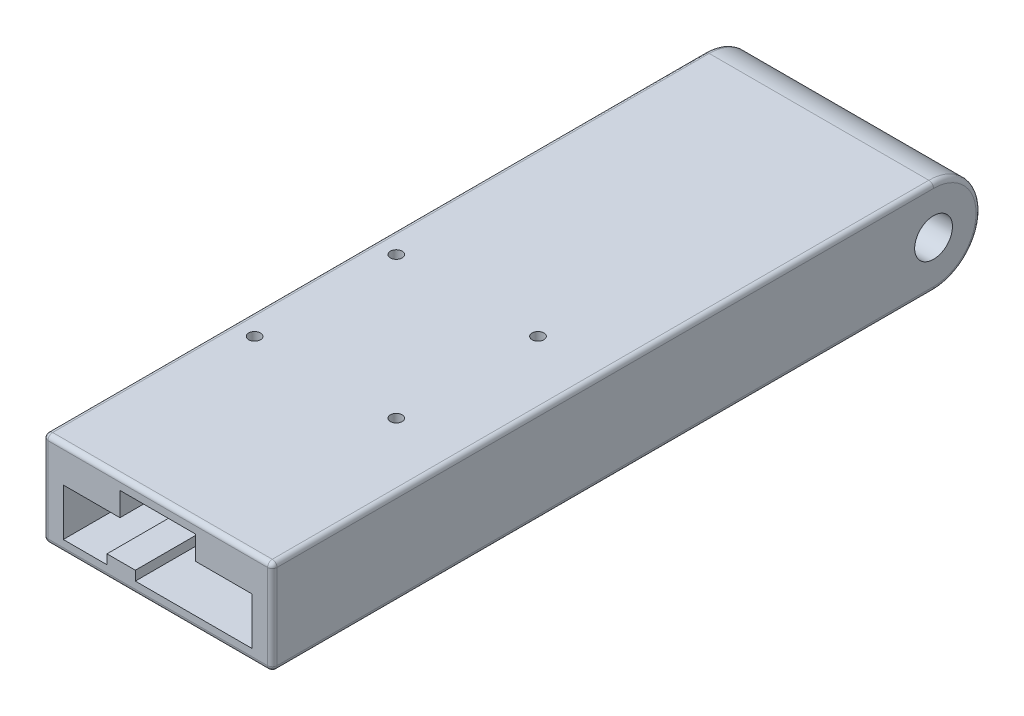
from build123d import *

# Parameters (mm, degrees)
SKETCH_1_W               = 48.5
SKETCH_1_H               = 150
EXTRUDE_1_DEPTH          = 20
CUT_EXTRUDE_1_REACH      = 93.527
CUT_EXTRUDE_2_REACH      = 93.527
SKETCH_4_R               = 4
M3X0_5_1_D               = 2.5
M3X0_5_1_DEPTH           = 7.5
M3X0_5_1_TIP             = 0.751075774
CUT_EXTRUDE_3_DEPTH      = 14
CUT_EXTRUDE_4_DEPTH      = 1
CUT_EXTRUDE_4_DEPTH_BACK = 6
CUT_EXTRUDE_5_DEPTH      = 120
FILLET_1_R               = 1


with BuildPart() as part:
    # 草图1 → 凸台-拉伸1 (new body)
    with BuildSketch(Plane(origin=(0, 0, 0), x_dir=(1, 0, 0), z_dir=(0, 1, 0))):
        Rectangle(SKETCH_1_W, SKETCH_1_H)
    extrude(amount=EXTRUDE_1_DEPTH)

    # 草图3 → 切除-拉伸1 (cut, up to next)
    with BuildSketch(Plane(origin=(24.25, 0, 0), x_dir=(0, 0, -1), z_dir=(1, 0, 0)), mode=Mode.PRIVATE) as cut_extrude_1_sk1:
        with BuildLine():
            Line((75, 0), (75, 10))
            ThreePointArc((75, 10), (72.071067812, 2.928932188), (65, 0))
            Line((65, 0), (75, 0))
        make_face()
    cut_extrude_1_tool1 = extrude(cut_extrude_1_sk1.sketch, amount=-CUT_EXTRUDE_1_REACH, mode=Mode.PRIVATE) & part.part
    # 草图3 → 切除-拉伸1 (cut, up to next)
    with BuildSketch(Plane(origin=(24.25, 0, 0), x_dir=(0, 0, -1), z_dir=(1, 0, 0)), mode=Mode.PRIVATE) as cut_extrude_1_sk2:
        with BuildLine():
            Line((75, 20), (65, 20))
            ThreePointArc((65, 20), (72.071067812, 17.071067812), (75, 10))
            Line((75, 10), (75, 20))
        make_face()
    cut_extrude_1_tool2 = extrude(cut_extrude_1_sk2.sketch, amount=-CUT_EXTRUDE_1_REACH, mode=Mode.PRIVATE) & part.part
    add(cut_extrude_1_tool1.solids().sort_by_distance((24.25, 2.233679, -72.766321))[0], mode=Mode.SUBTRACT)
    add(cut_extrude_1_tool2.solids().sort_by_distance((24.25, 17.766321, -72.766321))[0], mode=Mode.SUBTRACT)

    # 草图4 → 切除-拉伸2 (cut, up to next)
    with BuildSketch(Plane(origin=(24.25, 0, 0), x_dir=(0, 0, -1), z_dir=(1, 0, 0)), mode=Mode.PRIVATE) as cut_extrude_2_sk1:
        with Locations((65, 10)):
            Circle(SKETCH_4_R)
    cut_extrude_2_tool1 = extrude(cut_extrude_2_sk1.sketch, amount=-CUT_EXTRUDE_2_REACH, mode=Mode.PRIVATE) & part.part
    add(cut_extrude_2_tool1.solids().sort_by_distance((24.25, 10, -65))[0], mode=Mode.SUBTRACT)

    # M3x0.5 螺纹孔1
    with Locations(Plane(origin=(-19.5, 20, 5), x_dir=(0, 0, 1), z_dir=(0, 1, 0))):
        with Locations((0, 0), (0, 30), (30, 0), (30, 30)):
            Hole(M3X0_5_1_D / 2, depth=M3X0_5_1_DEPTH)
            with Locations((0, 0, -(M3X0_5_1_DEPTH + M3X0_5_1_TIP / 2))):  # 118° drill point
                Cone(0, M3X0_5_1_D / 2, M3X0_5_1_TIP, mode=Mode.SUBTRACT)

    # 草图9 → 切除-拉伸3 (cut)
    with BuildSketch(Plane.ZY.offset(24.25)):
        with BuildLine():
            Line((24.145780988, 0), (15.854219012, 0))
            ThreePointArc((15.854219012, 0), (20, 2.75), (24.145780988, 0))
        make_face()
    extrude(amount=-CUT_EXTRUDE_3_DEPTH, mode=Mode.SUBTRACT)

    # 草图10 → 切除-拉伸4 (cut, two sides: drawn at the far end of the back side and taken through both)
    with BuildSketch(Plane.ZY.offset(10.25).offset(-CUT_EXTRUDE_4_DEPTH_BACK)):
        with BuildLine():
            Line((28.828221792, 0), (11.171778208, 0))
            ThreePointArc((11.171778208, 0), (20, 7.25), (28.828221792, 0))
        make_face()
    extrude(amount=CUT_EXTRUDE_4_DEPTH + CUT_EXTRUDE_4_DEPTH_BACK, mode=Mode.SUBTRACT)

    # 草图11 → 切除-拉伸5 (cut)
    with BuildSketch(Plane.XY.offset(75)):
        Polygon((-4.7499492, 2.5), (20, 2.5), (20, 12.5), (8, 12.5), (8, 17.5), (-8, 17.5), (-8, 12.5), (-20, 12.5), (-20, 2.5), (-10.7499492, 2.5), (-10.7499492, 4.5), (-4.7499492, 4.5), align=None)
    extrude(amount=-CUT_EXTRUDE_5_DEPTH, mode=Mode.SUBTRACT)

    # 圆角1
    fillet_1_edges = [part.edges().sort_by_distance(p)[0] for p in [
        (-24.25, 0, -24.572890494),
        (0, 20, 75),
        (24.25, 10, -75),
        (-24.25, 10, -75),
        (-24.25, 20, 5),
        (24.25, 20, 5),
        (0, 0, 75),
        (-24.25, 0, 49.572890494),
        (24.25, 0, 5),
        (24.25, 10, 75),
        (-24.25, 10, 75),
    ]]
    fillet(fillet_1_edges, radius=FILLET_1_R)


solid = part.part
